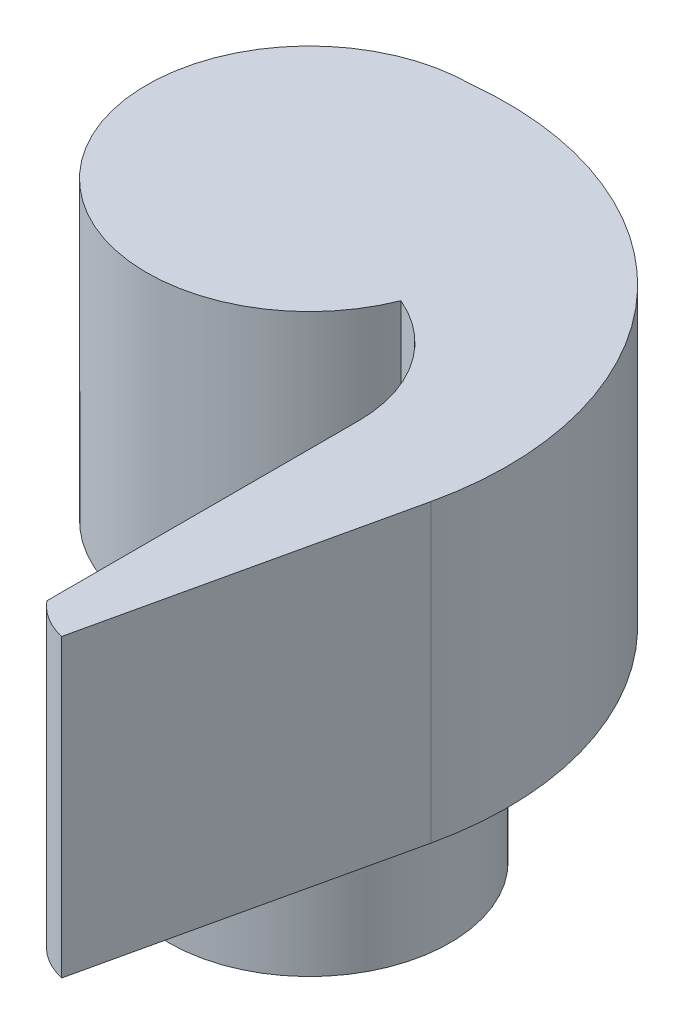
from build123d import *

# Parameters (mm, degrees)
BOSS_EXTRUDE1_DEPTH = 20
SKETCH2_R           = 9.5
BOSS_EXTRUDE2_DEPTH = 20


with BuildPart() as part:
    # Sketch1 → Boss-Extrude1 (new body)
    with BuildSketch(Plane(origin=(0, 0, 0), x_dir=(1, 0, 0), z_dir=(0, 1, 0))):
        with BuildLine():
            Line((18.424541272, -35.177357689), (23.005994318, -14.800530945))
            ThreePointArc((23.005994318, -14.800530945), (18.132040633, 4.01076546), (0, 11))
            ThreePointArc((0, 11), (-9.097635455, -6.183286273), (10.227869895, -4.048540158))
            ThreePointArc((10.227869895, -4.048540158), (14.304101202, -7.422369294), (15.833057178, -12.488006305))
            Line((15.833057178, -12.488006305), (15.833057178, -33.589930418))
            ThreePointArc((15.833057178, -33.589930418), (16.997270485, -34.598365473), (18.424541272, -35.177357689))
        make_face()
    extrude(amount=BOSS_EXTRUDE1_DEPTH)

    # Sketch2 → Boss-Extrude2 (add)
    with BuildSketch(Plane.XZ):
        with Locations(Location((0, 0, 0), (0, 0, 270))):
            Circle(SKETCH2_R)
    extrude(amount=BOSS_EXTRUDE2_DEPTH)


solid = part.part
